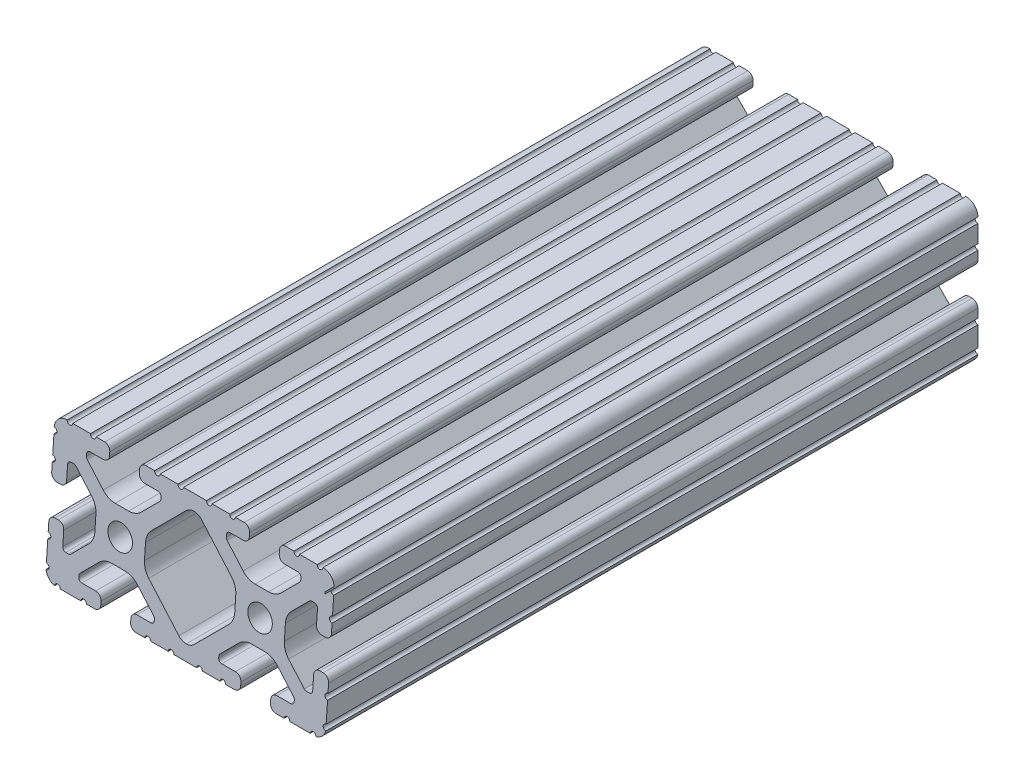
from build123d import *

# Parameters (mm, degrees)
SKETCH1_R          = 3.3274
EXTRUDE1_DEPTH     = 177.8
CUT_EXTRUDE1_DEPTH = 127


with BuildPart() as part:
    # Sketch1 → Extrude1 (new body)
    with BuildSketch(Plane.XY):
        with BuildLine():
            Line((-3.121121376, -19.05), (3.121121376, -19.05))
            ThreePointArc((3.121121376, -19.05), (3.883121376, -18.288), (4.645121376, -19.05))
            Line((4.645121376, -19.05), (8.633115796, -19.05))
            Line((8.633115796, -19.05), (9.473536067, -19.05))
            ThreePointArc((9.473536067, -19.05), (10.235536067, -18.288), (10.997536067, -19.05))
            Line((10.997536067, -19.05), (13.4112, -19.05))
            ThreePointArc((13.4112, -19.05), (14.524751759, -18.588751759), (14.986, -17.4752))
            Line((14.986, -17.4752), (14.986, -16.5608))
            ThreePointArc((14.986, -16.5608), (14.524751759, -15.447248241), (13.4112, -14.986))
            Line((13.4112, -14.986), (9.652, -14.986))
            ThreePointArc((9.652, -14.986), (9.023382072, -14.725617928), (8.763, -14.097))
            Line((8.763, -14.097), (8.763, -13.687179678))
            ThreePointArc((8.763, -13.687179678), (8.830670671, -13.346975131), (9.023380503, -13.058563318))
            Line((9.023380503, -13.058563318), (13.852498595, -8.229421131))
            ThreePointArc((13.852498595, -8.229421131), (15.393447522, -7.199787805), (17.211122763, -6.838228541))
            Line((17.211122763, -6.838228541), (20.888877237, -6.838228541))
            ThreePointArc((20.888877237, -6.838228541), (22.706552478, -7.199787805), (24.247501405, -8.229421131))
            Line((24.247501405, -8.229421131), (29.076619497, -13.058563318))
            ThreePointArc((29.076619497, -13.058563318), (29.269329329, -13.346975131), (29.337, -13.687179678))
            Line((29.337, -13.687179678), (29.337, -14.097))
            ThreePointArc((29.337, -14.097), (29.076617928, -14.725617928), (28.448, -14.986))
            Line((28.448, -14.986), (24.6888, -14.986))
            ThreePointArc((24.6888, -14.986), (23.575248241, -15.447248241), (23.114, -16.5608))
            Line((23.114, -16.5608), (23.114, -17.4752))
            ThreePointArc((23.114, -17.4752), (23.575248241, -18.588751759), (24.6888, -19.05))
            Line((24.6888, -19.05), (26.945817469, -19.05))
            ThreePointArc((26.945817469, -19.05), (27.707817469, -18.288), (28.469817469, -19.05))
            Line((28.469817469, -19.05), (29.207115796, -19.05))
            Line((29.207115796, -19.05), (34.047273398, -19.05))
            ThreePointArc((34.047273398, -19.05), (34.809273398, -18.288), (35.571273398, -19.05))
            ThreePointArc((35.571273398, -19.05), (37.207577603, -18.182738167), (38.1, -16.560019212))
            ThreePointArc((38.1, -16.560019212), (37.338, -15.798019212), (38.1, -15.036019212))
            Line((38.1, -15.036019212), (38.1, -10.287))
            Line((38.1, -10.287), (38.1, -9.549701672))
            ThreePointArc((38.1, -9.549701672), (37.338, -8.787701672), (38.1, -8.025701672))
            Line((38.1, -8.025701672), (38.1, -5.6388))
            ThreePointArc((38.1, -5.6388), (37.638751759, -4.525248241), (36.5252, -4.064))
            Line((36.5252, -4.064), (35.6108, -4.064))
            ThreePointArc((35.6108, -4.064), (34.497248241, -4.525248241), (34.036, -5.6388))
            Line((34.036, -5.6388), (34.036, -9.398))
            ThreePointArc((34.036, -9.398), (33.775617928, -10.026617928), (33.147, -10.287))
            Line((33.147, -10.287), (32.420656743, -10.287))
            ThreePointArc((32.420656743, -10.287), (32.080450147, -10.21932848), (31.792037247, -10.02661636))
            Line((31.792037247, -10.02661636), (27.197575832, -5.43213202))
            ThreePointArc((27.197575832, -5.43213202), (26.167954729, -3.891188903), (25.8064, -2.07352461))
            Line((25.8064, -2.07352461), (25.8064, 2.07352461))
            ThreePointArc((25.8064, 2.07352461), (26.167954729, 3.891188903), (27.197575832, 5.43213202))
            Line((27.197575832, 5.43213202), (31.792037247, 10.02661636))
            ThreePointArc((31.792037247, 10.02661636), (32.080450147, 10.21932848), (32.420656743, 10.287))
            Line((32.420656743, 10.287), (33.147, 10.287))
            ThreePointArc((33.147, 10.287), (33.775617928, 10.026617928), (34.036, 9.398))
            Line((34.036, 9.398), (34.036, 5.6388))
            ThreePointArc((34.036, 5.6388), (34.497248241, 4.525248241), (35.6108, 4.064))
            Line((35.6108, 4.064), (36.5252, 4.064))
            ThreePointArc((36.5252, 4.064), (37.638751759, 4.525248241), (38.1, 5.6388))
            Line((38.1, 5.6388), (38.1, 8.025701672))
            ThreePointArc((38.1, 8.025701672), (37.338, 8.787701672), (38.1, 9.549701672))
            Line((38.1, 9.549701672), (38.1, 10.287))
            Line((38.1, 10.287), (38.1, 14.375206214))
            ThreePointArc((38.1, 14.375206214), (37.338232276, 15.156019383), (38.137614868, 15.89827725))
            ThreePointArc((38.137614868, 15.89827725), (37.148019028, 18.192014021), (34.819536496, 19.096833012))
            ThreePointArc((34.819536496, 19.096833012), (34.081312886, 18.311776389), (33.296256263, 19.05))
            Line((33.296256263, 19.05), (29.207115796, 19.05))
            Line((29.207115796, 19.05), (28.469817468, 19.05))
            ThreePointArc((28.469817468, 19.05), (27.707817468, 18.288), (26.945817468, 19.05))
            Line((26.945817468, 19.05), (24.558915796, 19.05))
            ThreePointArc((24.558915796, 19.05), (23.53023695, 18.547208069), (23.114, 17.480565346))
            Line((23.114, 17.480565346), (23.114, 16.5608))
            ThreePointArc((23.114, 16.5608), (23.575248241, 15.447248241), (24.6888, 14.986))
            Line((24.6888, 14.986), (28.295243665, 14.986))
            ThreePointArc((28.295243665, 14.986), (28.923861593, 14.725617928), (29.184243665, 14.097))
            Line((29.184243665, 14.097), (29.184243665, 13.53442258))
            ThreePointArc((29.184243665, 13.53442258), (29.116572993, 13.194218033), (28.923863161, 12.90580622))
            Line((28.923863161, 12.90580622), (24.247501405, 8.229421131))
            ThreePointArc((24.247501405, 8.229421131), (22.706552478, 7.199787805), (20.888877237, 6.838228541))
            Line((20.888877237, 6.838228541), (17.211122763, 6.838228541))
            ThreePointArc((17.211122763, 6.838228541), (15.393447522, 7.199787805), (13.852498595, 8.229421131))
            Line((13.852498595, 8.229421131), (9.176136839, 12.90580622))
            ThreePointArc((9.176136839, 12.90580622), (8.983427007, 13.194218033), (8.915756335, 13.53442258))
            Line((8.915756335, 13.53442258), (8.915756335, 14.097))
            ThreePointArc((8.915756335, 14.097), (9.176138407, 14.725617928), (9.804756335, 14.986))
            Line((9.804756335, 14.986), (13.4112, 14.986))
            ThreePointArc((13.4112, 14.986), (14.524751759, 15.447248241), (14.986, 16.5608))
            Line((14.986, 16.5608), (14.986, 17.496772581))
            ThreePointArc((14.986, 17.496772581), (14.531070222, 18.595070222), (13.432772581, 19.05))
            Line((13.432772581, 19.05), (10.997536067, 19.05))
            ThreePointArc((10.997536067, 19.05), (10.235536067, 18.288), (9.473536067, 19.05))
            Line((9.473536067, 19.05), (8.633115796, 19.05))
            Line((8.633115796, 19.05), (4.645121376, 19.05))
            ThreePointArc((4.645121376, 19.05), (3.883121376, 18.288), (3.121121376, 19.05))
            Line((3.121121376, 19.05), (-3.121121376, 19.05))
            ThreePointArc((-3.121121376, 19.05), (-3.883121376, 18.288), (-4.645121376, 19.05))
            Line((-4.645121376, 19.05), (-8.633115796, 19.05))
            Line((-8.633115796, 19.05), (-9.473536067, 19.05))
            ThreePointArc((-9.473536067, 19.05), (-10.235536067, 18.288), (-10.997536067, 19.05))
            Line((-10.997536067, 19.05), (-13.432772581, 19.05))
            ThreePointArc((-13.432772581, 19.05), (-14.531070222, 18.595070222), (-14.986, 17.496772581))
            Line((-14.986, 17.496772581), (-14.986, 16.5608))
            ThreePointArc((-14.986, 16.5608), (-14.524751759, 15.447248241), (-13.4112, 14.986))
            Line((-13.4112, 14.986), (-9.804756335, 14.986))
            ThreePointArc((-9.804756335, 14.986), (-9.176138407, 14.725617928), (-8.915756335, 14.097))
            Line((-8.915756335, 14.097), (-8.915756335, 13.53442258))
            ThreePointArc((-8.915756335, 13.53442258), (-8.983427007, 13.194218033), (-9.176136839, 12.90580622))
            Line((-9.176136839, 12.90580622), (-13.852498595, 8.229421131))
            ThreePointArc((-13.852498595, 8.229421131), (-15.393447522, 7.199787805), (-17.211122763, 6.838228541))
            Line((-17.211122763, 6.838228541), (-20.888877237, 6.838228541))
            ThreePointArc((-20.888877237, 6.838228541), (-22.706552478, 7.199787805), (-24.247501405, 8.229421131))
            Line((-24.247501405, 8.229421131), (-28.923863161, 12.90580622))
            ThreePointArc((-28.923863161, 12.90580622), (-29.116572993, 13.194218033), (-29.184243665, 13.53442258))
            Line((-29.184243665, 13.53442258), (-29.184243665, 14.097))
            ThreePointArc((-29.184243665, 14.097), (-28.923861593, 14.725617928), (-28.295243665, 14.986))
            Line((-28.295243665, 14.986), (-24.6888, 14.986))
            ThreePointArc((-24.6888, 14.986), (-23.575248241, 15.447248241), (-23.114, 16.5608))
            Line((-23.114, 16.5608), (-23.114, 17.480565346))
            ThreePointArc((-23.114, 17.480565346), (-23.53023695, 18.547208069), (-24.558915796, 19.05))
            Line((-24.558915796, 19.05), (-26.945817468, 19.05))
            ThreePointArc((-26.945817468, 19.05), (-27.707817468, 18.288), (-28.469817468, 19.05))
            Line((-28.469817468, 19.05), (-29.207115796, 19.05))
            Line((-29.207115796, 19.05), (-33.296256263, 19.05))
            ThreePointArc((-33.296256263, 19.05), (-34.081312886, 18.311776389), (-34.819536496, 19.096833012))
            ThreePointArc((-34.819536496, 19.096833012), (-37.148019028, 18.192014021), (-38.137614868, 15.89827725))
            ThreePointArc((-38.137614868, 15.89827725), (-37.338232276, 15.156019383), (-38.1, 14.375206214))
            Line((-38.1, 14.375206214), (-38.1, 10.287))
            Line((-38.1, 10.287), (-38.1, 9.549701672))
            ThreePointArc((-38.1, 9.549701672), (-37.338, 8.787701672), (-38.1, 8.025701672))
            Line((-38.1, 8.025701672), (-38.1, 5.6388))
            ThreePointArc((-38.1, 5.6388), (-37.638751759, 4.525248241), (-36.5252, 4.064))
            Line((-36.5252, 4.064), (-35.6108, 4.064))
            ThreePointArc((-35.6108, 4.064), (-34.497248241, 4.525248241), (-34.036, 5.6388))
            Line((-34.036, 5.6388), (-34.036, 9.398))
            ThreePointArc((-34.036, 9.398), (-33.775617928, 10.026617928), (-33.147, 10.287))
            Line((-33.147, 10.287), (-32.420656743, 10.287))
            ThreePointArc((-32.420656743, 10.287), (-32.080450147, 10.21932848), (-31.792037247, 10.02661636))
            Line((-31.792037247, 10.02661636), (-27.197575832, 5.43213202))
            ThreePointArc((-27.197575832, 5.43213202), (-26.167954729, 3.891188903), (-25.8064, 2.07352461))
            Line((-25.8064, 2.07352461), (-25.8064, -2.07352461))
            ThreePointArc((-25.8064, -2.07352461), (-26.167954729, -3.891188903), (-27.197575832, -5.43213202))
            Line((-27.197575832, -5.43213202), (-31.792037247, -10.02661636))
            ThreePointArc((-31.792037247, -10.02661636), (-32.080450147, -10.21932848), (-32.420656743, -10.287))
            Line((-32.420656743, -10.287), (-33.147, -10.287))
            ThreePointArc((-33.147, -10.287), (-33.775617928, -10.026617928), (-34.036, -9.398))
            Line((-34.036, -9.398), (-34.036, -5.6388))
            ThreePointArc((-34.036, -5.6388), (-34.497248241, -4.525248241), (-35.6108, -4.064))
            Line((-35.6108, -4.064), (-36.5252, -4.064))
            ThreePointArc((-36.5252, -4.064), (-37.638751759, -4.525248241), (-38.1, -5.6388))
            Line((-38.1, -5.6388), (-38.1, -8.025701672))
            ThreePointArc((-38.1, -8.025701672), (-37.338, -8.787701672), (-38.1, -9.549701672))
            Line((-38.1, -9.549701672), (-38.1, -10.287))
            Line((-38.1, -10.287), (-38.1, -15.036019212))
            ThreePointArc((-38.1, -15.036019212), (-37.338, -15.798019212), (-38.1, -16.560019212))
            ThreePointArc((-38.1, -16.560019212), (-37.20882252, -18.184002456), (-35.571273398, -19.05))
            ThreePointArc((-35.571273398, -19.05), (-34.809273398, -18.288), (-34.047273398, -19.05))
            Line((-34.047273398, -19.05), (-29.207115796, -19.05))
            Line((-29.207115796, -19.05), (-28.469817469, -19.05))
            ThreePointArc((-28.469817469, -19.05), (-27.707817469, -18.288), (-26.945817469, -19.05))
            Line((-26.945817469, -19.05), (-24.6888, -19.05))
            ThreePointArc((-24.6888, -19.05), (-23.575248241, -18.588751759), (-23.114, -17.4752))
            Line((-23.114, -17.4752), (-23.114, -16.5608))
            ThreePointArc((-23.114, -16.5608), (-23.575248241, -15.447248241), (-24.6888, -14.986))
            Line((-24.6888, -14.986), (-28.448, -14.986))
            ThreePointArc((-28.448, -14.986), (-29.076617928, -14.725617928), (-29.337, -14.097))
            Line((-29.337, -14.097), (-29.337, -13.687179678))
            ThreePointArc((-29.337, -13.687179678), (-29.269329329, -13.346975131), (-29.076619497, -13.058563318))
            Line((-29.076619497, -13.058563318), (-24.247501405, -8.229421131))
            ThreePointArc((-24.247501405, -8.229421131), (-22.706552478, -7.199787805), (-20.888877237, -6.838228541))
            Line((-20.888877237, -6.838228541), (-17.211122763, -6.838228541))
            ThreePointArc((-17.211122763, -6.838228541), (-15.393447522, -7.199787805), (-13.852498595, -8.229421131))
            Line((-13.852498595, -8.229421131), (-9.023380503, -13.058563318))
            ThreePointArc((-9.023380503, -13.058563318), (-8.830670671, -13.346975131), (-8.763, -13.687179678))
            Line((-8.763, -13.687179678), (-8.763, -14.097))
            ThreePointArc((-8.763, -14.097), (-9.023382072, -14.725617928), (-9.652, -14.986))
            Line((-9.652, -14.986), (-13.4112, -14.986))
            ThreePointArc((-13.4112, -14.986), (-14.524751759, -15.447248241), (-14.986, -16.5608))
            Line((-14.986, -16.5608), (-14.986, -17.4752))
            ThreePointArc((-14.986, -17.4752), (-14.524751759, -18.588751759), (-13.4112, -19.05))
            Line((-13.4112, -19.05), (-10.997536067, -19.05))
            ThreePointArc((-10.997536067, -19.05), (-10.235536067, -18.288), (-9.473536067, -19.05))
            Line((-9.473536067, -19.05), (-8.633115796, -19.05))
            Line((-8.633115796, -19.05), (-4.645121376, -19.05))
            ThreePointArc((-4.645121376, -19.05), (-3.883121376, -18.288), (-3.121121376, -19.05))
        make_face()
        with Locations((19.05, 0)):
            Circle(SKETCH1_R, mode=Mode.SUBTRACT)
        with Locations(Location((-19.05, 0, 0), (0, 0, 180))):
            Circle(SKETCH1_R, mode=Mode.SUBTRACT)
        with BuildLine():
            Line((2.077035361, 14.257564863), (10.902424168, 5.43213202))
            ThreePointArc((10.902424168, 5.43213202), (11.932045271, 3.891188903), (12.2936, 2.07352461))
            Line((12.2936, 2.07352461), (12.2936, -2.07352461))
            ThreePointArc((12.2936, -2.07352461), (11.932045271, -3.891188903), (10.902424168, -5.43213202))
            Line((10.902424168, -5.43213202), (2.077035361, -14.257564863))
            ThreePointArc((2.077035361, -14.257564863), (1.124045601, -14.892973012), (0, -15.113096807))
            ThreePointArc((0, -15.113096807), (-1.124045601, -14.892973012), (-2.077035361, -14.257564863))
            Line((-2.077035361, -14.257564863), (-10.902424168, -5.43213202))
            ThreePointArc((-10.902424168, -5.43213202), (-11.932045271, -3.891188903), (-12.2936, -2.07352461))
            Line((-12.2936, -2.07352461), (-12.2936, 2.07352461))
            ThreePointArc((-12.2936, 2.07352461), (-11.932045271, 3.891188903), (-10.902424168, 5.43213202))
            Line((-10.902424168, 5.43213202), (-2.077035361, 14.257564863))
            ThreePointArc((-2.077035361, 14.257564863), (-1.124045601, 14.892973012), (0, 15.113096807))
            ThreePointArc((0, 15.113096807), (1.124045601, 14.892973012), (2.077035361, 14.257564863))
        make_face(mode=Mode.SUBTRACT)
    extrude(amount=-EXTRUDE1_DEPTH)

    # Sketch2 → Cut-Extrude1 (cut)
    with BuildSketch(Plane(origin=(38.1, 0, 0), x_dir=(0, 0, -1), z_dir=(1, 0, 0))):
        Polygon((0, -19.05), (2.6675617, 19.097909589), (0, 19.097909589), align=None)
    extrude(amount=-CUT_EXTRUDE1_DEPTH, mode=Mode.SUBTRACT)


solid = part.part
